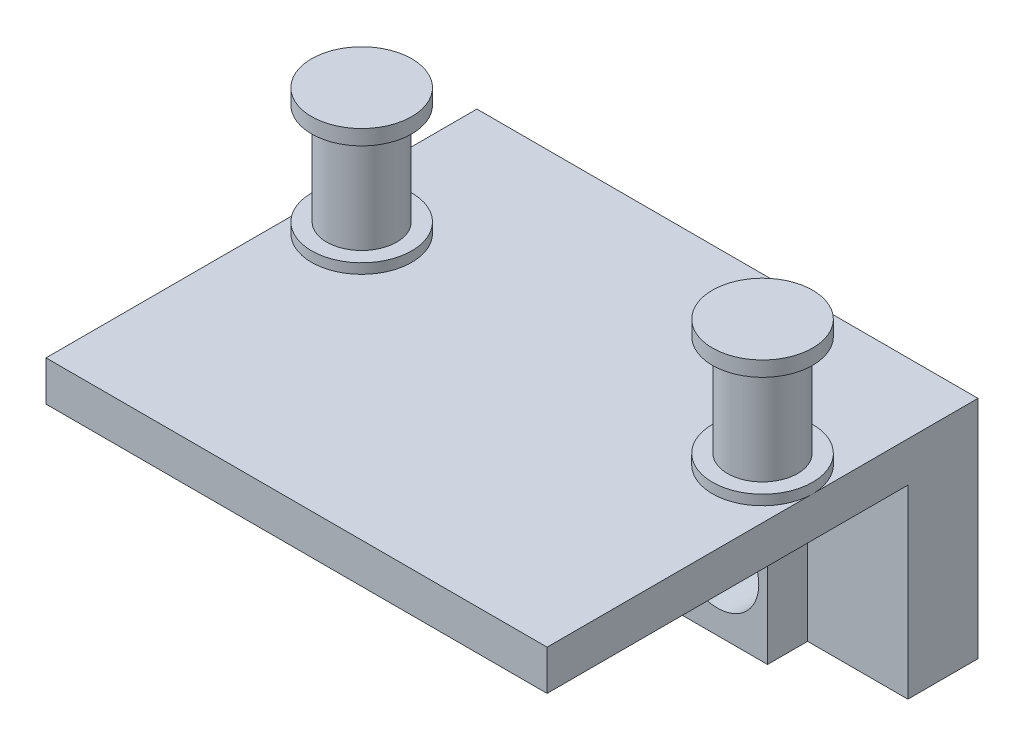
from build123d import *

# Parameters (mm, degrees)
BOSS_EXTRUDE1_DEPTH = 30
SKETCH2_R           = 4.125
CUT_EXTRUDE1_DEPTH  = 53.821779702
SKETCH3_W           = 36
SKETCH3_H           = 3.997849999
BOSS_EXTRUDE2_DEPTH = 10
SKETCH4_W           = 36
SKETCH4_H           = 4
BOSS_EXTRUDE3_DEPTH = 10
SKETCH5_R           = 5
BOSS_EXTRUDE4_DEPTH = 12.6
BOSS_EXTRUDE5_START = 7
SKETCH6_W           = 30
SKETCH6_H           = 22.5
SKETCH6_R           = 4.125
BOSS_EXTRUDE5_DEPTH = 7
SKETCH8_R           = 5
SKETCH8_R_2         = 3.5
CUT_EXTRUDE2_DEPTH  = 10.1
SKETCH9_W           = 7
SKETCH9_H           = 22.5
BOSS_EXTRUDE6_DEPTH = 10
SKETCH10_W          = 7
SKETCH10_H          = 22.5
BOSS_EXTRUDE7_DEPTH = 10


with BuildPart() as part:
    # Sketch1 → Boss-Extrude1 (new body)
    with BuildSketch(Plane(origin=(0, 0, 0), x_dir=(0, 0, -1), z_dir=(1, 0, 0))):
        Polygon((16.698859865, -1.874995608), (-15.301140135, -1.874995608), (-15.301140135, -5.874995608), (-6.301140135, -5.874995608), (-5.301140135, -6.674995608), (6.198859865, -6.674995608), (7.198859865, -5.874995608), (16.198859865, -5.874995608), (17.698859865, -6.874995608), (17.698859865, -12.374995608), (16.698859865, -13.374995608), (16.698859865, -24.374995608), (20.698859865, -24.374995608), (20.698859865, -1.874995608), align=None)
    extrude(amount=BOSS_EXTRUDE1_DEPTH)

    # Sketch2 → Cut-Extrude1 (cut, through all)
    with BuildSketch(Plane(origin=(0, 0, -20.698859865), x_dir=(-1, 0, 0), z_dir=(0, 0, -1))):
        with Locations((-25, -17.874995608)):
            Circle(SKETCH2_R)
        with Locations(Location((-5, -17.874995608, 0), (0, 0, 90))):
            Circle(SKETCH2_R)
    extrude(amount=-CUT_EXTRUDE1_DEPTH, mode=Mode.SUBTRACT)

    # Sketch3 → Boss-Extrude2 (add)
    with BuildSketch(Plane.ZY):
        with Locations((-2.698859865, -3.873920608)):
            Rectangle(SKETCH3_W, SKETCH3_H)
    extrude(amount=BOSS_EXTRUDE2_DEPTH)

    # Sketch4 → Boss-Extrude3 (add)
    with BuildSketch(Plane(origin=(30, 0, 0), x_dir=(0, 0, -1), z_dir=(1, 0, 0))):
        with Locations((2.698859865, -3.874995608)):
            Rectangle(SKETCH4_W, SKETCH4_H)
    extrude(amount=BOSS_EXTRUDE3_DEPTH)

    # Sketch5 → Boss-Extrude4 (add)
    with BuildSketch(Plane(origin=(0, -1.874995608, 0), x_dir=(1, 0, 0), z_dir=(0, 1, 0))):
        with Locations((35, 11.198859865)):
            Circle(SKETCH5_R)
        with Locations(Location((-5, 11.198859865, 0), (0, 0, 90))):
            Circle(SKETCH5_R)
    extrude(amount=BOSS_EXTRUDE4_DEPTH)

    # Sketch6 → Boss-Extrude5 (add)
    with BuildSketch(Plane(origin=(0, 0, -20.698859865), x_dir=(-1, 0, 0), z_dir=(0, 0, -1)).offset(BOSS_EXTRUDE5_START)):
        with Locations((-15, -13.124995608)):
            Rectangle(SKETCH6_W, SKETCH6_H)
        with Locations(Location((-25, -17.874995608, 0), (0, 0, 90))):
            Circle(SKETCH6_R, mode=Mode.SUBTRACT)
        with Locations(Location((-5, -17.874995608, 0), (0, 0, 90))):
            Circle(SKETCH6_R, mode=Mode.SUBTRACT)
    extrude(amount=-BOSS_EXTRUDE5_DEPTH)

    # Sketch8 → Cut-Extrude2 (cut)
    # profile 1 of 2: a face of its own
    with BuildSketch(Plane(origin=(0, -0.874995608, 0), x_dir=(1, 0, 0), z_dir=(0, 1, 0))):
        with Locations(Location((-5, 11.198859865, 0), (0, 0, 180))):
            Circle(SKETCH8_R)
        with Locations(Location((-5, 11.198859865, 0), (0, 0, 90))):
            Circle(SKETCH8_R_2, mode=Mode.SUBTRACT)
    # profile 2 of 2: a face of its own
    with BuildSketch(Plane(origin=(0, -0.874995608, 0), x_dir=(1, 0, 0), z_dir=(0, 1, 0))):
        with Locations((35, 11.198859865)):
            Circle(SKETCH8_R)
        with Locations(Location((35, 11.198859865, 0), (0, 0, 90))):
            Circle(SKETCH8_R_2, mode=Mode.SUBTRACT)
    extrude(amount=CUT_EXTRUDE2_DEPTH, mode=Mode.SUBTRACT)

    # Sketch9 → Boss-Extrude6 (add)
    with BuildSketch(Plane(origin=(30, 0, 0), x_dir=(0, 0, -1), z_dir=(1, 0, 0))):
        with Locations((24.198859865, -13.124995608)):
            Rectangle(SKETCH9_W, SKETCH9_H)
    extrude(amount=BOSS_EXTRUDE6_DEPTH)

    # Sketch10 → Boss-Extrude7 (add)
    with BuildSketch(Plane.ZY):
        with Locations((-24.198859865, -13.124995608)):
            Rectangle(SKETCH10_W, SKETCH10_H)
    extrude(amount=BOSS_EXTRUDE7_DEPTH)


solid = part.part
